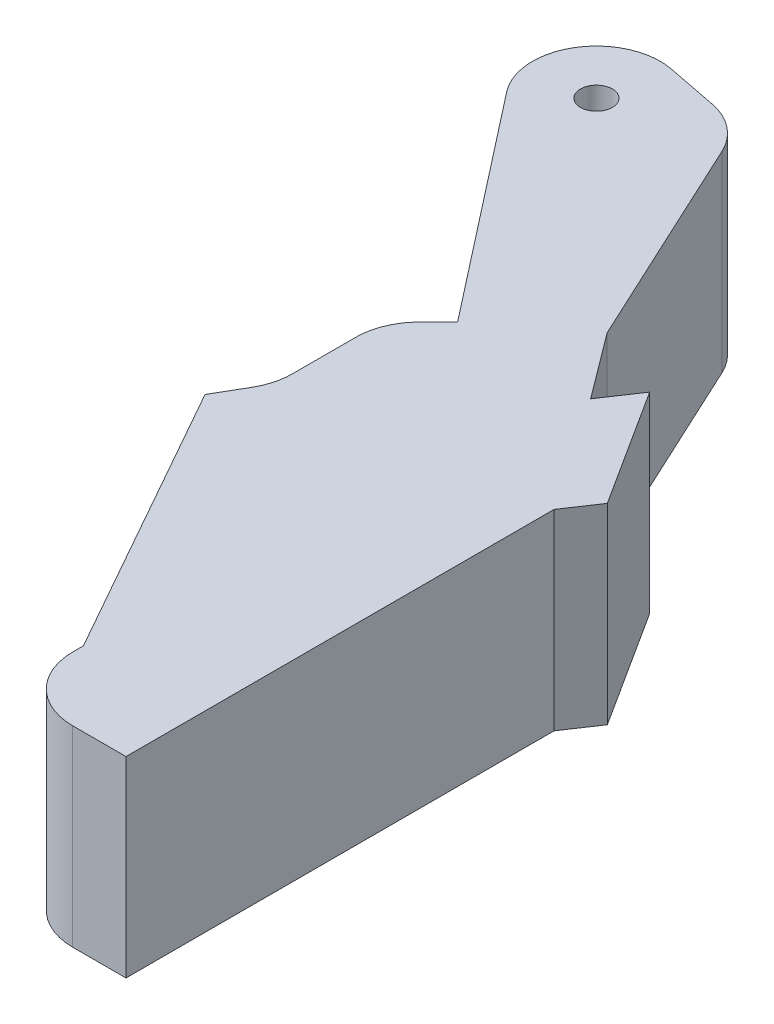
from build123d import *

# Parameters (mm, degrees)
BOSS_EXTRUDE1_DEPTH = 9
FILLET1_R           = 6
FILLET2_R           = 6
FILLET3_R           = 6
SKETCH4_R           = 1.5
CUT_EXTRUDE2_DEPTH  = 99.948249762


with BuildPart() as part:
    # Sketch1 → Boss-Extrude1 (new, symmetric)
    with BuildSketch(Plane(origin=(0, 0, 0), x_dir=(1, 0, 0), z_dir=(0, 1, 0))):
        Polygon((26.298098503, -33.68255382), (0, 0), (23.549059428, -4.630529132), (34.208885562, -27.565410034), (38.800851719, -33.702486103), (41.023010007, -30.384019108), (48.078540091, -41.414607796), (46.07366082, -44.408600496), (46.07366082, -84.588475064), (35.07366082, -84.588475064), (35.07366082, -77.588475064), (20.351319641, -51.449372742), (22.771974432, -47.270927217), (22.771974432, -37.270927217), align=None)
    extrude(amount=BOSS_EXTRUDE1_DEPTH, both=True)

    # Fillet1
    fillet1_edges = [part.edges().sort_by_distance(p)[0] for p in [
        (0, 0, 0),
        (23.549059428, 0, 4.630529132),
    ]]
    fillet(fillet1_edges, radius=FILLET1_R)

    # Fillet2
    fillet2_edges = [part.edges().sort_by_distance(p)[0] for p in [
        (22.771974432, 0, 47.270927217),
        (22.771974432, 0, 37.270927217),
    ]]
    fillet(fillet2_edges, radius=FILLET2_R)

    # Fillet3
    fillet3_edges = [part.edges().sort_by_distance(p)[0] for p in [
        (35.07366082, 0, 84.588475064),
    ]]
    fillet(fillet3_edges, radius=FILLET3_R)

    # Sketch4 → Cut-Extrude2 (cut, through all)
    with BuildSketch(Plane(origin=(0, 9, 0), x_dir=(1, 0, 0), z_dir=(0, 1, 0))):
        with Locations(Location((14.632977879, -8.992224551, 0), (0, 0, 270))):
            Circle(SKETCH4_R)
    extrude(amount=-CUT_EXTRUDE2_DEPTH, mode=Mode.SUBTRACT)


solid = part.part
